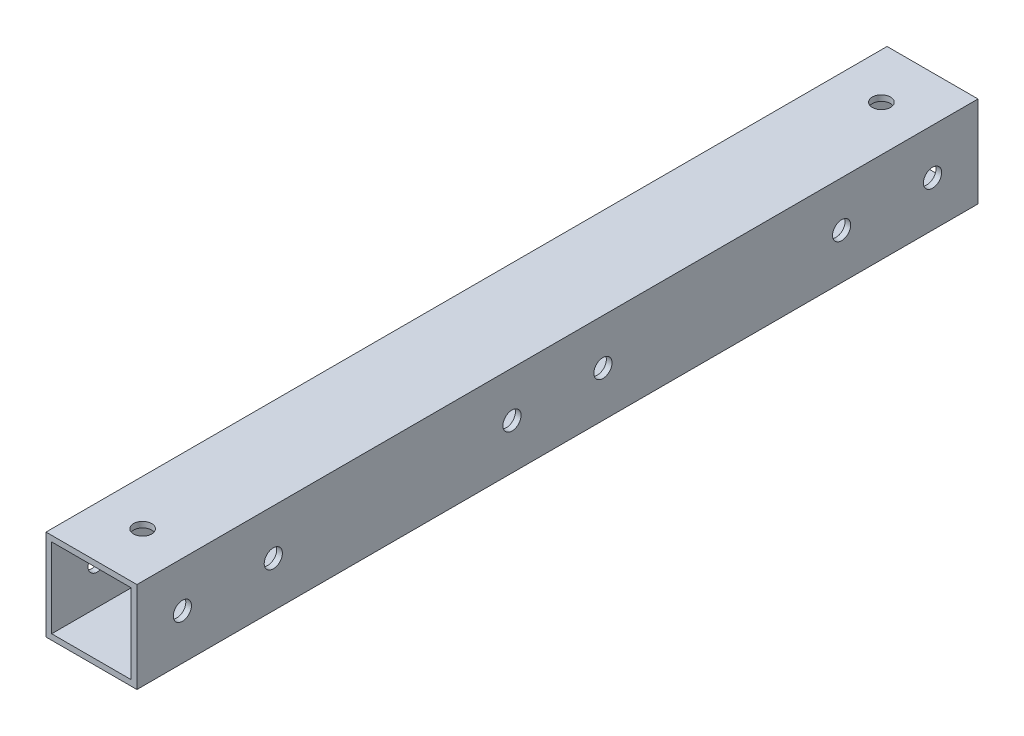
from build123d import *

# Parameters (mm, degrees)
SKETCH1_W           = 25.4
SKETCH1_H           = 25.4
SKETCH1_W_2         = 22.225
SKETCH1_H_2         = 22.225
BOSS_EXTRUDE1_DEPTH = 234.95
SKETCH4_R           = 2.54
CUT_EXTRUDE3_DEPTH  = 238.680084357
CUT_EXTRUDE4_REACH  = 239.68
SKETCH5_R           = 2.54


with BuildPart() as part:
    # Sketch1 → Boss-Extrude1 (new body)
    with BuildSketch(Plane.XY):
        with Locations((12.7, 12.7)):
            Rectangle(SKETCH1_W, SKETCH1_H)
        with Locations((12.7, 12.7)):
            Rectangle(SKETCH1_W_2, SKETCH1_H_2, mode=Mode.SUBTRACT)
    extrude(amount=BOSS_EXTRUDE1_DEPTH)

    # Sketch4 → Cut-Extrude3 (cut, through all)
    with BuildSketch(Plane(origin=(25.4, 0, 0), x_dir=(0, 0, -1), z_dir=(1, 0, 0))):
        with Locations((-222.25, 12.7)):
            Circle(SKETCH4_R)
        with Locations((-196.85, 12.7)):
            Circle(SKETCH4_R)
        with Locations(Location((-38.1, 12.7, 0), (0, 0, 180))):
            Circle(SKETCH4_R)
        with Locations(Location((-12.7, 12.7, 0), (0, 0, 180))):
            Circle(SKETCH4_R)
        with Locations((-104.775, 12.7)):
            Circle(SKETCH4_R)
        with Locations(Location((-130.175, 12.7, 0), (0, 0, 180))):
            Circle(SKETCH4_R)
    extrude(amount=-CUT_EXTRUDE3_DEPTH, mode=Mode.SUBTRACT)

    # Sketch5 → Cut-Extrude4 (cut, up to next)
    with BuildSketch(Plane(origin=(0, 25.4, 0), x_dir=(1, 0, 0), z_dir=(0, 1, 0)), mode=Mode.PRIVATE) as cut_extrude4_sk1:
        with Locations(Location((12.7, -220.6625, 0), (0, 0, 270))):
            Circle(SKETCH5_R)
    cut_extrude4_tool1 = extrude(cut_extrude4_sk1.sketch, amount=-CUT_EXTRUDE4_REACH, mode=Mode.PRIVATE) & part.part
    # Sketch5 → Cut-Extrude4 (cut, up to next)
    with BuildSketch(Plane(origin=(0, 25.4, 0), x_dir=(1, 0, 0), z_dir=(0, 1, 0)), mode=Mode.PRIVATE) as cut_extrude4_sk2:
        with Locations(Location((12.7, -14.2875, 0), (0, 0, 270))):
            Circle(SKETCH5_R)
    cut_extrude4_tool2 = extrude(cut_extrude4_sk2.sketch, amount=-CUT_EXTRUDE4_REACH, mode=Mode.PRIVATE) & part.part
    add(cut_extrude4_tool1.solids().sort_by_distance((12.7, 25.4, 220.6625))[0], mode=Mode.SUBTRACT)
    add(cut_extrude4_tool2.solids().sort_by_distance((12.7, 25.4, 14.2875))[0], mode=Mode.SUBTRACT)


solid = part.part
